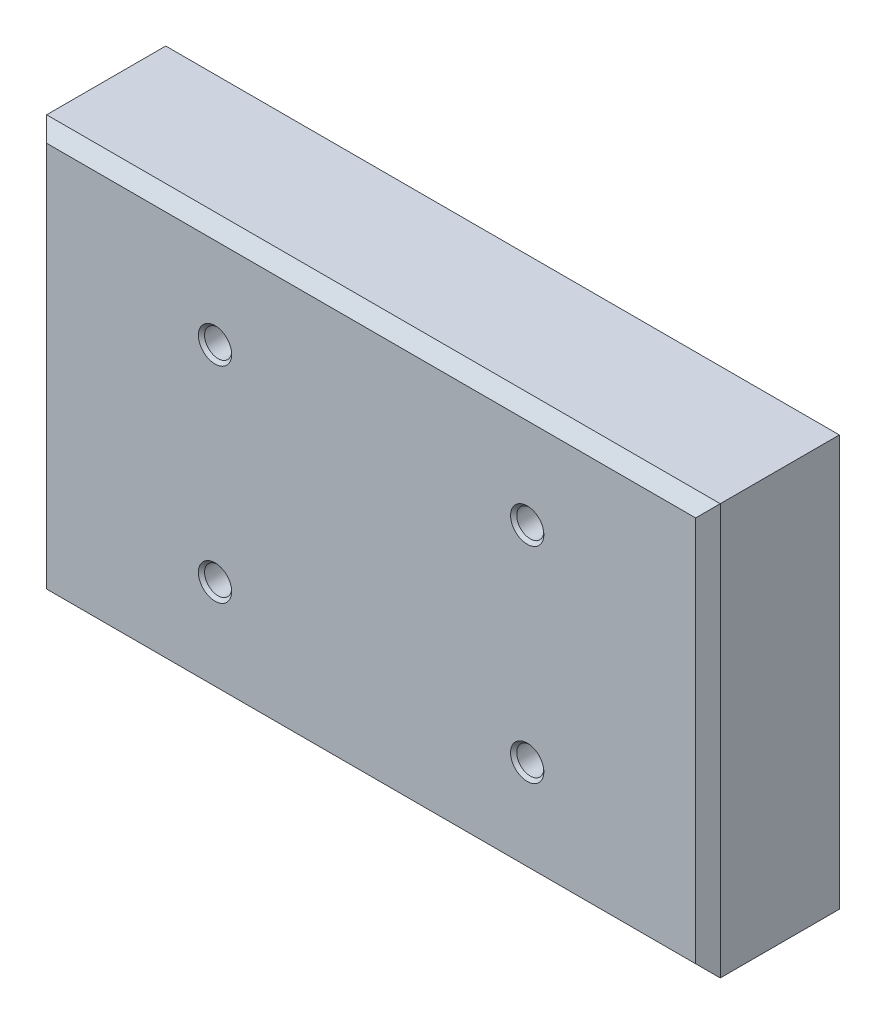
from build123d import *

# Parameters (mm, degrees)
SKETCH1_W                   = 82
SKETCH1_H                   = 50
BOSS_EXTRUDE4_DEPTH         = 16
M4_TAPPED_HOLE1_D           = 3.3
M4_TAPPED_HOLE1_DEPTH       = 8
M4_TAPPED_HOLE1_CSINK_D     = 4.05
M4_TAPPED_HOLE1_CSINK_ANGLE = 90
M4_TAPPED_HOLE1_TIP         = 0.991420021
CHAMFER1_SIZE               = 1.5
SCALE1_SCALE                = 1.5


with BuildPart() as part:
    # Sketch1 → Boss-Extrude4 (new body)
    with BuildSketch(Plane.XY):
        with Locations((-41, 25)):
            Rectangle(SKETCH1_W, SKETCH1_H)
    extrude(amount=BOSS_EXTRUDE4_DEPTH)

    # M4 Tapped Hole1
    with Locations(Plane.XY.offset(16)):
        with Locations((-60, 37.5), (-60, 12.5), (-22, 12.5), (-22, 37.5)):
            CounterSinkHole(M4_TAPPED_HOLE1_D / 2, M4_TAPPED_HOLE1_CSINK_D / 2, depth=M4_TAPPED_HOLE1_DEPTH, counter_sink_angle=M4_TAPPED_HOLE1_CSINK_ANGLE)
            with Locations((0, 0, -(M4_TAPPED_HOLE1_DEPTH + M4_TAPPED_HOLE1_TIP / 2))):  # 118° drill point
                Cone(0, M4_TAPPED_HOLE1_D / 2, M4_TAPPED_HOLE1_TIP, mode=Mode.SUBTRACT)

    # Chamfer1
    chamfer1_edges = [part.edges().sort_by_distance(p)[0] for p in [
        (-82, 25, 16),
        (-41, 0, 16),
        (0, 25, 16),
        (-41, 50, 16),
    ]]
    chamfer(chamfer1_edges, length=CHAMFER1_SIZE)


with BuildPart() as part_1:
    # Scale1: scaled about (-41, 25, 7.949093999)
    add(part.part.scale(SCALE1_SCALE).moved(Location((20.5, -12.5, -3.974546999))))


solid = part_1.part
